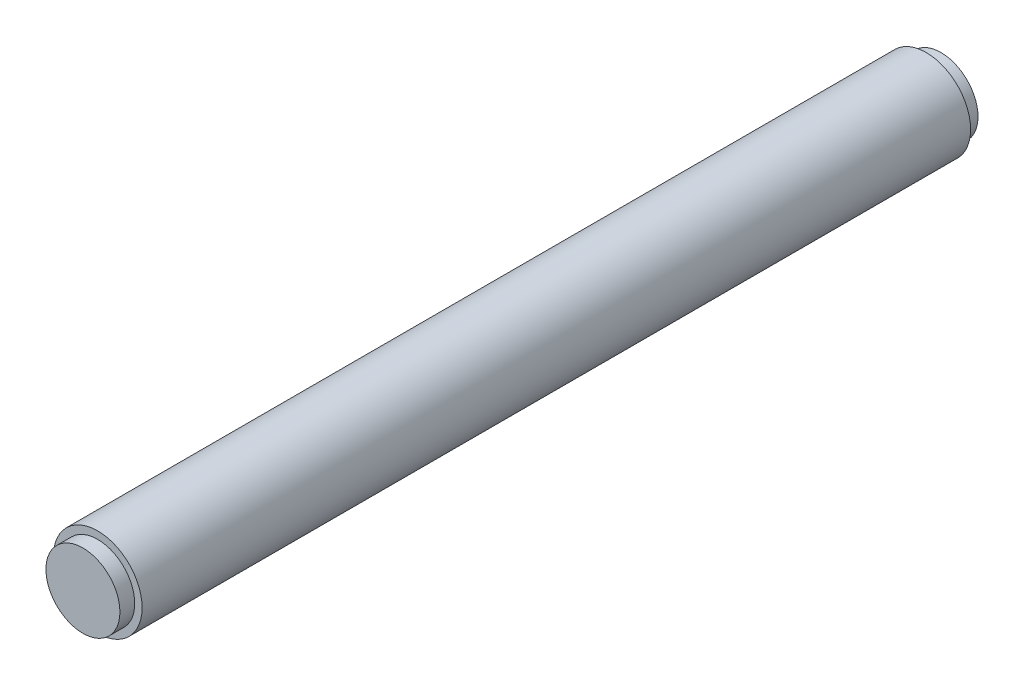
from build123d import *

# Parameters (mm, degrees)
CROQUIS1_R              = 30
SALIENTE_EXTRUIR1_DEPTH = 560
CROQUIS2_R              = 25
SALIENTE_EXTRUIR2_DEPTH = 10
SALIENTE_EXTRUIR3_START = 10
CROQUIS3_R              = 25
SALIENTE_EXTRUIR3_DEPTH = 10


with BuildPart() as part:
    # Croquis1 → Saliente-Extruir1 (new body)
    with BuildSketch(Plane.XY):
        with Locations((-8.737256795, 10.745405819)):
            Circle(CROQUIS1_R)
    extrude(amount=SALIENTE_EXTRUIR1_DEPTH)

    # Croquis2 → Saliente-Extruir2 (add)
    with BuildSketch(Plane.XY.offset(560)):
        with Locations((-8.737256795, 10.745405819)):
            Circle(CROQUIS2_R)
    extrude(amount=SALIENTE_EXTRUIR2_DEPTH)

    # Croquis3 → Saliente-Extruir3 (add)
    with BuildSketch(Plane(origin=(0, 0, 0), x_dir=(-1, 0, 0), z_dir=(0, 0, -1)).offset(SALIENTE_EXTRUIR3_START)):
        with Locations(Location((8.737256795, 10.745405819, 0), (0, 0, 180))):
            Circle(CROQUIS3_R)
    extrude(amount=-SALIENTE_EXTRUIR3_DEPTH)


solid = part.part
